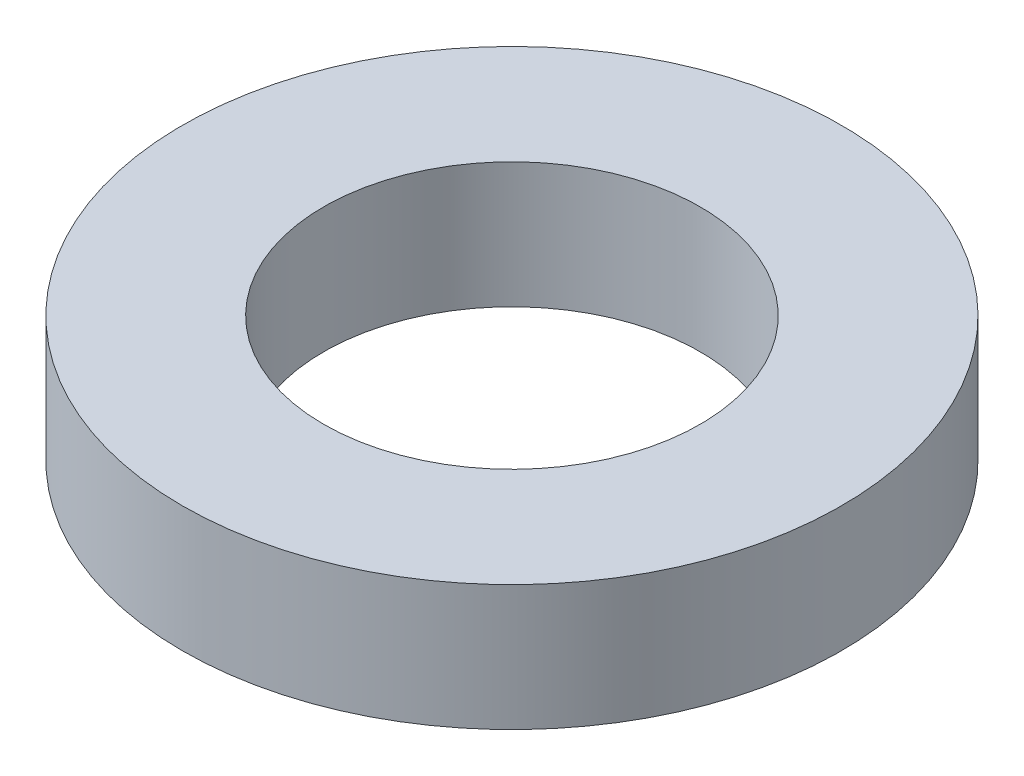
from build123d import *

# Parameters (mm, degrees)
SKETCH_1_R      = 10.5
SKETCH_1_R_2    = 6
EXTRUDE_1_DEPTH = 2
SKETCH_2_R      = 10.5
SKETCH_2_R_2    = 6
EXTRUDE_2_DEPTH = 2


with BuildPart() as part:
    # 草图1 → 凸台-拉伸1 (new body)
    with BuildSketch(Plane(origin=(0, 0, 0), x_dir=(1, 0, 0), z_dir=(0, 1, 0))):
        with Locations(Location((0, 0, 0), (0, 0, 270))):
            Circle(SKETCH_1_R)
        with Locations(Location((0, 0, 0), (0, 0, 270))):
            Circle(SKETCH_1_R_2, mode=Mode.SUBTRACT)
    extrude(amount=EXTRUDE_1_DEPTH)

    # 草图2 → 凸台-拉伸2 (add)
    with BuildSketch(Plane(origin=(0, 2, 0), x_dir=(1, 0, 0), z_dir=(0, 1, 0))):
        with Locations(Location((0, 0, 0), (0, 0, 270))):
            Circle(SKETCH_2_R)
        with Locations(Location((0, 0, 0), (0, 0, 270))):
            Circle(SKETCH_2_R_2, mode=Mode.SUBTRACT)
    extrude(amount=EXTRUDE_2_DEPTH)


solid = part.part
